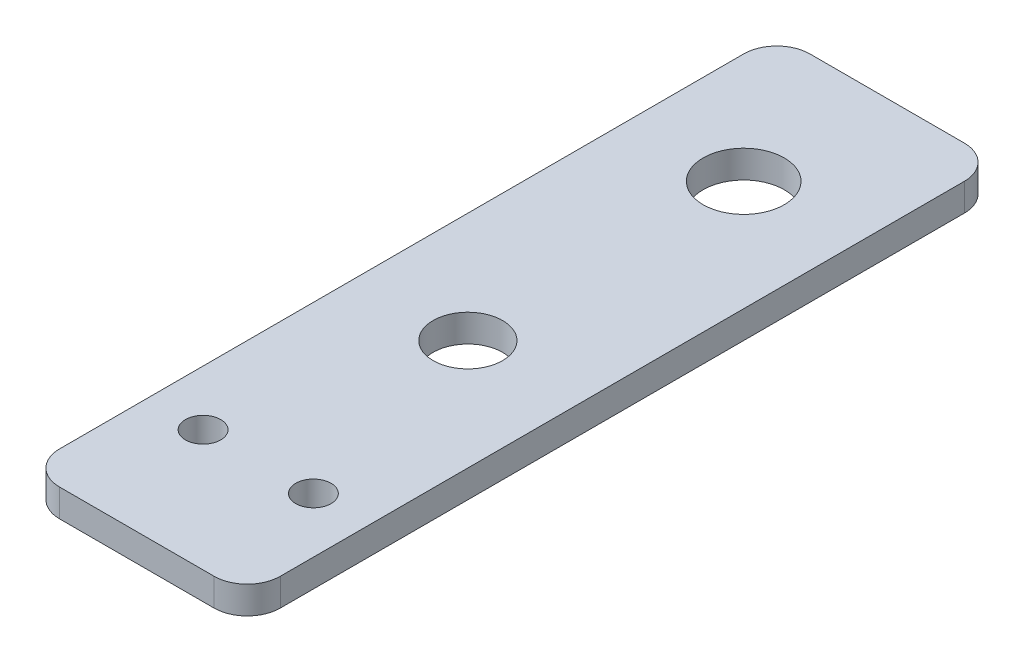
from build123d import *

# Parameters (mm, degrees)
SKETCH1_W           = 25.4
SKETCH1_H           = 86.36
SKETCH1_R           = 2.032
SKETCH1_R_2         = 4
SKETCH1_R_3         = 4.669733183
BOSS_EXTRUDE1_DEPTH = 3.175
FILLET1_R           = 3.81


with BuildPart() as part:
    # Sketch1 → Boss-Extrude1 (new body)
    with BuildSketch(Plane(origin=(0, 0, 0), x_dir=(1, 0, 0), z_dir=(0, 1, 0))):
        Rectangle(SKETCH1_W, SKETCH1_H)
        with Locations(Location((-6.35, -29.21, 0), (0, 0, 270))):
            Circle(SKETCH1_R, mode=Mode.SUBTRACT)
        with Locations(Location((6.35, -29.21, 0), (0, 0, 270))):
            Circle(SKETCH1_R, mode=Mode.SUBTRACT)
        with Locations(Location((0, -5.08, 0), (0, 0, 270))):
            Circle(SKETCH1_R_2, mode=Mode.SUBTRACT)
        with Locations(Location((0, 26.67, 0), (0, 0, 270))):
            Circle(SKETCH1_R_3, mode=Mode.SUBTRACT)
    extrude(amount=BOSS_EXTRUDE1_DEPTH)

    # Fillet1
    fillet1_edges = [part.edges().sort_by_distance(p)[0] for p in [
        (-12.7, 1.5875, 43.18),
        (-12.7, 1.5875, -43.18),
        (12.7, 1.5875, -43.18),
        (12.7, 1.5875, 43.18),
    ]]
    fillet(fillet1_edges, radius=FILLET1_R)


solid = part.part
